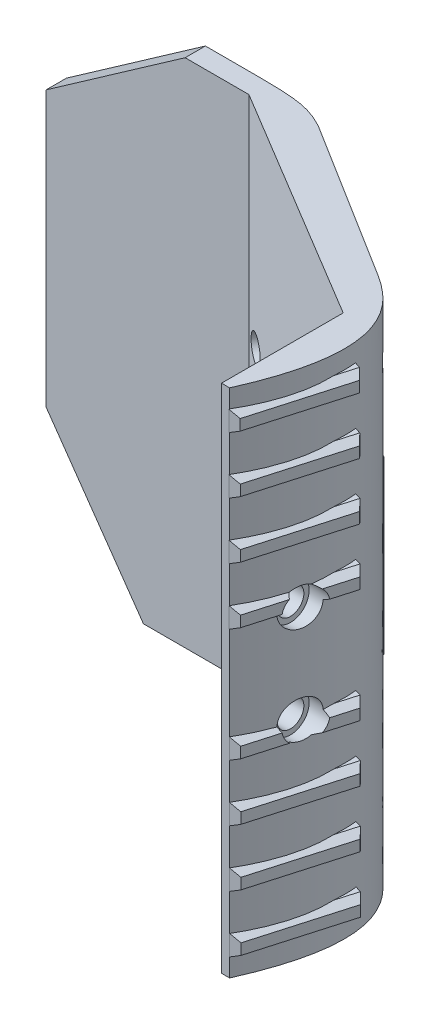
from build123d import *
from OCP.BRepFilletAPI import BRepFilletAPI_MakeChamfer

# Parameters (mm, degrees)
EXTRUDE_1_DEPTH           = 63
SKETCH_2_W                = 15
SKETCH_2_H                = 22
EXTRUDE_2_DEPTH           = 1
EXTRUDE_2_TAPER           = 25
CUT_EXTRUDE_1_DEPTH       = 0.6
SKETCH_7_W                = 9
SKETCH_7_H                = 26
EXTRUDE_4_DEPTH           = 2
EXTRUDE_4_TAPER           = 35
EXTRUDE_4_OTHER_WAY_DEPTH = 2
SKETCH_4_R                = 1.65
CUT_EXTRUDE_2_DEPTH       = 83.575294142
SKETCH_5_R                = 2.3
CUT_EXTRUDE_3_DEPTH       = 83.861648478
SKETCH_10_W               = 13.042406147
SKETCH_10_H               = 2.5
EXTRUDE_6_DEPTH           = 1
EXTRUDE_6_DRAFT           = -30
SKETCH_10_W_2             = 13.042406148
EXTRUDE_6_PROFILE_2_DEPTH = 1
EXTRUDE_6_PROFILE_2_DRAFT = -30
EXTRUDE_6_PROFILE_3_DEPTH = 1
EXTRUDE_6_PROFILE_3_DRAFT = -30
EXTRUDE_6_PROFILE_4_DEPTH = 1
EXTRUDE_6_PROFILE_4_DRAFT = -30
EXTRUDE_6_PROFILE_5_DEPTH = 1
EXTRUDE_6_PROFILE_5_DRAFT = -30
EXTRUDE_6_PROFILE_6_DEPTH = 1
EXTRUDE_6_PROFILE_6_DRAFT = -30
EXTRUDE_6_PROFILE_7_DEPTH = 1
EXTRUDE_6_PROFILE_7_DRAFT = -30
EXTRUDE_6_PROFILE_8_DEPTH = 1
EXTRUDE_6_PROFILE_8_DRAFT = -30
EXTRUDE_7_REACH           = 91.907
SKETCH_11_W               = 2.664181327
SKETCH_11_H               = 2.5
SKETCH_11_W_2             = 2.653969198
SKETCH_11_W_3             = 2.643757069
SKETCH_11_W_4             = 2.633544939
SKETCH_11_W_5             = 2.613120681
SKETCH_11_W_6             = 2.602908552
SKETCH_11_W_7             = 2.582484293
SKETCH_11_W_8             = 2.592696422
SKETCH_12_R               = 1.65
CUT_EXTRUDE_4_DEPTH       = 2
SKETCH_13_R               = 2.3
CUT_EXTRUDE_5_DEPTH       = 87.97206171
CHAMFER_1_SIZE            = 12
CHAMFER_1_SIZE2           = 17.137776081


with BuildPart() as part:
    # 草图1 → 凸台-拉伸1 (new body)
    with BuildSketch(Plane(origin=(0, 0, 0), x_dir=(1, 0, 0), z_dir=(0, 1, 0))):
        with BuildLine():
            Line((44.43880649, -6.019716675), (44.43880649, -21.019716675))
            Line((44.43880649, -21.019716675), (45.43880649, -21.019716675))
            add(Edge.make_bspline(
                [(41.651819028, 0.714585318), (45.340469838, -1.589284913), (52.31055273, -5.585521918), (45.43880649, -21.019716675)],
                knots=[0.746299074, 0.746299074, 0.746299074, 0.746299074, 1, 1, 1, 1], degree=3))
            Line((41.651819028, 0.714585318), (22.849473052, 12.458219345))
            add(Edge.make_bspline(
                [(12.078403115, 13.980283325), (18.082153885, 13.980283325), (20.026953764, 13.972630056), (22.849473052, 12.458219345)],
                knots=[0, 0, 0, 0, 0.428174205, 0.428174205, 0.428174205, 0.428174205], degree=3))
            Line((12.078403115, 13.980283325), (10.078403115, 13.980283325))
            Line((10.078403115, 13.980283325), (-9.686084451, 13.980283325))
            Line((-9.686084451, 13.980283325), (-9.686084451, 11.480283325))
            Line((-9.686084451, 11.480283325), (15.313915549, 11.480283325))
            Line((15.313915549, 11.480283325), (44.43880649, -6.019716675))
        make_face()
    extrude(amount=EXTRUDE_1_DEPTH)

    # 草图2 → 凸台-拉伸2 (add)
    with BuildSketch(Plane(origin=(12.009801855, 0, -19.228498526), x_dir=(-0.848157054218371, 0, -0.5297448549817312), z_dir=(0.5297448549817312, 0, -0.848157054218371))):
        with Locations((-26.948736234, 31.5)):
            Rectangle(SKETCH_2_W, SKETCH_2_H)
    extrude(amount=EXTRUDE_2_DEPTH, taper=EXTRUDE_2_TAPER)

    # 草图3 → 切除-拉伸1 (cut)
    with BuildSketch(Plane(origin=(12.53954671, 0, -20.07665558), x_dir=(-0.848157054218371, 0, -0.5297448549817311), z_dir=(0.5297448549817312, 0, -0.8481570542183711))):
        with BuildLine():
            Line((-24.827415891, 31.5), (-21.645435375, 34.681980515))
            ThreePointArc((-21.645435375, 34.681980515), (-21.645435375, 36.803300859), (-23.766755719, 36.803300859))
            Line((-23.766755719, 36.803300859), (-26.948736234, 33.621320344))
            Line((-26.948736234, 33.621320344), (-24.827415891, 31.5))
        make_face()
        Polygon((-26.948736234, 29.378679656), (-24.827415891, 31.5), (-26.948736234, 33.621320344), (-29.070056578, 31.5), align=None)
        with BuildLine():
            Line((-21.645435375, 28.318019485), (-24.827415891, 31.5))
            Line((-24.827415891, 31.5), (-26.948736234, 29.378679656))
            Line((-26.948736234, 29.378679656), (-23.766755719, 26.196699141))
            ThreePointArc((-23.766755719, 26.196699141), (-21.645435375, 26.196699141), (-21.645435375, 28.318019485))
        make_face()
        with BuildLine():
            Line((-30.13071675, 26.196699141), (-26.948736234, 29.378679656))
            Line((-26.948736234, 29.378679656), (-29.070056578, 31.5))
            Line((-29.070056578, 31.5), (-32.252037093, 28.318019485))
            ThreePointArc((-32.252037093, 28.318019485), (-32.252037093, 26.196699141), (-30.13071675, 26.196699141))
        make_face()
        with BuildLine():
            Line((-29.070056578, 31.5), (-26.948736234, 33.621320344))
            Line((-26.948736234, 33.621320344), (-30.13071675, 36.803300859))
            ThreePointArc((-30.13071675, 36.803300859), (-32.252037093, 36.803300859), (-32.252037093, 34.681980515))
            Line((-32.252037093, 34.681980515), (-29.070056578, 31.5))
        make_face()
    extrude(amount=-CUT_EXTRUDE_1_DEPTH, mode=Mode.SUBTRACT)

    # 草图7 → 凸台-拉伸4 (add)
    with BuildSketch(Plane(origin=(2.78506898, 0, -15.794911074), x_dir=(0.9848077530122076, 0, 0.1736481776669333), z_dir=(0.1736481776669333, 0, -0.9848077530122076))):
        with Locations((17.267254309, -31.5)):
            Rectangle(SKETCH_7_W, SKETCH_7_H)
    extrude(amount=EXTRUDE_4_DEPTH, taper=EXTRUDE_4_TAPER)

    # 草图7 → 凸台-拉伸4 other way (add)
    with BuildSketch(Plane(origin=(2.78506898, 0, -15.794911074), x_dir=(0.9848077530122076, 0, 0.1736481776669333), z_dir=(0.1736481776669333, 0, -0.9848077530122076))):
        with Locations((17.267254309, -31.5)):
            Rectangle(SKETCH_7_W, SKETCH_7_H)
    extrude(amount=-EXTRUDE_4_OTHER_WAY_DEPTH)

    # 草图4 → 切除-拉伸2 (cut, through all)
    with BuildSketch(Plane(origin=(9.130478106, 0, -15.195667375), x_dir=(0.8571673007021101, 0, 0.5150380749100577), z_dir=(-0.5150380749100577, 0, 0.8571673007021101))):
        with Locations((9.652833984, 25.5)):
            Circle(SKETCH_4_R)
        with Locations(Location((9.652833984, 37.5, 0), (0, 0, 180))):
            Circle(SKETCH_4_R)
    extrude(amount=-CUT_EXTRUDE_2_DEPTH, mode=Mode.SUBTRACT)

    # 草图5 → 切除-拉伸3 (cut, through all)
    with BuildSketch(Plane(origin=(10.160554255, 0, -16.910001977), x_dir=(0.8571673007021101, 0, 0.5150380749100577), z_dir=(-0.5150380749100577, 0, 0.8571673007021101))):
        with Locations((9.652833984, 25.5)):
            Circle(SKETCH_5_R)
        with Locations((9.652833984, 37.5)):
            Circle(SKETCH_5_R)
    extrude(amount=-CUT_EXTRUDE_3_DEPTH, mode=Mode.SUBTRACT)


with BuildPart() as extrude_6_tool:
    # 草图10 → 凸台-拉伸6 (with draft: the straight prism first)
    with BuildSketch(Plane(origin=(47.55592631, 0, 13.636442435), x_dir=(-0.2756373558169962, 0, 0.9612616959383197), z_dir=(-0.9612616959383197, 0, -0.2756373558169962))):
        with Locations((1.159612952, 3.500029796)):
            Rectangle(SKETCH_10_W, SKETCH_10_H)
    extrude(amount=-EXTRUDE_6_DEPTH)
    # 凸台-拉伸6: the draft: its side faces are tilted about the plane it starts from
    extrude_6_sides = [extrude_6_tool.faces().sort_by_distance(p)[0] for p in [
        (47.71692451, 4.750029796, 14.888952626),
        (49.514411682, 3.500029796, 8.6203699),
        (47.71692451, 2.250029796, 14.888952626),
        (45.919437338, 3.500029796, 21.157535352),
    ]]
    draft(extrude_6_sides, Plane(origin=(47.55592631, 0, 13.636442435), x_dir=(-0.2756373558169962, 0, 0.9612616959383197), z_dir=(-0.9612616959383197, 0, -0.2756373558169962)), EXTRUDE_6_DRAFT)


with BuildPart() as part_1:
    add(part.part)

    # 凸台-拉伸6: add extrude_6_tool
    add(extrude_6_tool.part)


with BuildPart() as extrude_6_profile_2_tool:
    # 草图10 → 凸台-拉伸6 profile 2 (with draft: the straight prism first)
    with BuildSketch(Plane(origin=(47.55592631, 0, 13.636442435), x_dir=(-0.2756373558169962, 0, 0.9612616959383197), z_dir=(-0.9612616959383197, 0, -0.2756373558169962))):
        with Locations((1.169825082, 10.500022347)):
            Rectangle(SKETCH_10_W_2, SKETCH_10_H)
    extrude(amount=-EXTRUDE_6_PROFILE_2_DEPTH)
    # 凸台-拉伸6 profile 2: the draft: its side faces are tilted about the plane it starts from
    extrude_6_profile_2_sides = [extrude_6_profile_2_tool.faces().sort_by_distance(p)[0] for p in [
        (47.714109666, 11.750022347, 14.898769155),
        (49.511596838, 10.500022347, 8.630186429),
        (47.714109666, 9.250022347, 14.898769155),
        (45.916622494, 10.500022347, 21.167351881),
    ]]
    draft(extrude_6_profile_2_sides, Plane(origin=(47.55592631, 0, 13.636442435), x_dir=(-0.2756373558169962, 0, 0.9612616959383197), z_dir=(-0.9612616959383197, 0, -0.2756373558169962)), EXTRUDE_6_PROFILE_2_DRAFT)


with BuildPart() as part_2:
    add(part_1.part)

    # 凸台-拉伸6 profile 2: add extrude_6_profile_2_tool
    add(extrude_6_profile_2_tool.part)


with BuildPart() as extrude_6_profile_3_tool:
    # 草图10 → 凸台-拉伸6 profile 3 (with draft: the straight prism first)
    with BuildSketch(Plane(origin=(47.55592631, 0, 13.636442435), x_dir=(-0.2756373558169962, 0, 0.9612616959383197), z_dir=(-0.9612616959383197, 0, -0.2756373558169962))):
        with Locations((1.190249341, 24.500007449)):
            Rectangle(SKETCH_10_W, SKETCH_10_H)
    extrude(amount=-EXTRUDE_6_PROFILE_3_DEPTH)
    # 凸台-拉伸6 profile 3: the draft: its side faces are tilted about the plane it starts from
    extrude_6_profile_3_sides = [extrude_6_profile_3_tool.faces().sort_by_distance(p)[0] for p in [
        (47.708479977, 25.750007449, 14.918402212),
        (49.505967149, 24.500007449, 8.649819486),
        (47.708479977, 23.250007449, 14.918402212),
        (45.910992805, 24.500007449, 21.186984939),
    ]]
    draft(extrude_6_profile_3_sides, Plane(origin=(47.55592631, 0, 13.636442435), x_dir=(-0.2756373558169962, 0, 0.9612616959383197), z_dir=(-0.9612616959383197, 0, -0.2756373558169962)), EXTRUDE_6_PROFILE_3_DRAFT)


with BuildPart() as part_3:
    add(part_2.part)

    # 凸台-拉伸6 profile 3: add extrude_6_profile_3_tool
    add(extrude_6_profile_3_tool.part)


with BuildPart() as extrude_6_profile_4_tool:
    # 草图10 → 凸台-拉伸6 profile 4 (with draft: the straight prism first)
    with BuildSketch(Plane(origin=(47.55592631, 0, 13.636442435), x_dir=(-0.2756373558169962, 0, 0.9612616959383197), z_dir=(-0.9612616959383197, 0, -0.2756373558169962))):
        with Locations((1.220885728, 45.499985102)):
            Rectangle(SKETCH_10_W_2, SKETCH_10_H)
    extrude(amount=-EXTRUDE_6_PROFILE_4_DEPTH)
    # 凸台-拉伸6 profile 4: the draft: its side faces are tilted about the plane it starts from
    extrude_6_profile_4_sides = [extrude_6_profile_4_tool.faces().sort_by_distance(p)[0] for p in [
        (47.700035444, 46.749985102, 14.947851798),
        (49.497522616, 45.499985102, 8.679269072),
        (47.700035444, 44.249985102, 14.947851798),
        (45.902548272, 45.499985102, 21.216434525),
    ]]
    draft(extrude_6_profile_4_sides, Plane(origin=(47.55592631, 0, 13.636442435), x_dir=(-0.2756373558169962, 0, 0.9612616959383197), z_dir=(-0.9612616959383197, 0, -0.2756373558169962)), EXTRUDE_6_PROFILE_4_DRAFT)


with BuildPart() as part_4:
    add(part_3.part)

    # 凸台-拉伸6 profile 4: add extrude_6_profile_4_tool
    add(extrude_6_profile_4_tool.part)


with BuildPart() as extrude_6_profile_5_tool:
    # 草图10 → 凸台-拉伸6 profile 5 (with draft: the straight prism first)
    with BuildSketch(Plane(origin=(47.55592631, 0, 13.636442435), x_dir=(-0.2756373558169962, 0, 0.9612616959383197), z_dir=(-0.9612616959383197, 0, -0.2756373558169962))):
        with Locations((1.231097858, 52.499977653)):
            Rectangle(SKETCH_10_W, SKETCH_10_H)
    extrude(amount=-EXTRUDE_6_PROFILE_5_DEPTH)
    # 凸台-拉伸6 profile 5: the draft: its side faces are tilted about the plane it starts from
    extrude_6_profile_5_sides = [extrude_6_profile_5_tool.faces().sort_by_distance(p)[0] for p in [
        (47.6972206, 53.749977653, 14.957668327),
        (49.494707772, 52.499977653, 8.689085601),
        (47.6972206, 51.249977653, 14.957668327),
        (45.899733428, 52.499977653, 21.226251053),
    ]]
    draft(extrude_6_profile_5_sides, Plane(origin=(47.55592631, 0, 13.636442435), x_dir=(-0.2756373558169962, 0, 0.9612616959383197), z_dir=(-0.9612616959383197, 0, -0.2756373558169962)), EXTRUDE_6_PROFILE_5_DRAFT)


with BuildPart() as part_5:
    add(part_4.part)

    # 凸台-拉伸6 profile 5: add extrude_6_profile_5_tool
    add(extrude_6_profile_5_tool.part)


with BuildPart() as extrude_6_profile_6_tool:
    # 草图10 → 凸台-拉伸6 profile 6 (with draft: the straight prism first)
    with BuildSketch(Plane(origin=(47.55592631, 0, 13.636442435), x_dir=(-0.2756373558169962, 0, 0.9612616959383197), z_dir=(-0.9612616959383197, 0, -0.2756373558169962))):
        with Locations((1.241309987, 59.499970204)):
            Rectangle(SKETCH_10_W, SKETCH_10_H)
    extrude(amount=-EXTRUDE_6_PROFILE_6_DEPTH)
    # 凸台-拉伸6 profile 6: the draft: its side faces are tilted about the plane it starts from
    extrude_6_profile_6_sides = [extrude_6_profile_6_tool.faces().sort_by_distance(p)[0] for p in [
        (47.694405756, 60.749970204, 14.967484856),
        (49.491892928, 59.499970204, 8.698902129),
        (47.694405756, 58.249970204, 14.967484856),
        (45.896918584, 59.499970204, 21.236067582),
    ]]
    draft(extrude_6_profile_6_sides, Plane(origin=(47.55592631, 0, 13.636442435), x_dir=(-0.2756373558169962, 0, 0.9612616959383197), z_dir=(-0.9612616959383197, 0, -0.2756373558169962)), EXTRUDE_6_PROFILE_6_DRAFT)


with BuildPart() as part_6:
    add(part_5.part)

    # 凸台-拉伸6 profile 6: add extrude_6_profile_6_tool
    add(extrude_6_profile_6_tool.part)


with BuildPart() as extrude_6_profile_7_tool:
    # 草图10 → 凸台-拉伸6 profile 7 (with draft: the straight prism first)
    with BuildSketch(Plane(origin=(47.55592631, 0, 13.636442435), x_dir=(-0.2756373558169962, 0, 0.9612616959383197), z_dir=(-0.9612616959383197, 0, -0.2756373558169962))):
        with Locations((1.180037211, 17.500014898)):
            Rectangle(SKETCH_10_W_2, SKETCH_10_H)
    extrude(amount=-EXTRUDE_6_PROFILE_7_DEPTH)
    # 凸台-拉伸6 profile 7: the draft: its side faces are tilted about the plane it starts from
    extrude_6_profile_7_sides = [extrude_6_profile_7_tool.faces().sort_by_distance(p)[0] for p in [
        (49.508781993, 17.500014898, 8.640002957),
        (47.711294821, 16.250014898, 14.908585684),
        (45.913807649, 17.500014898, 21.17716841),
        (47.711294821, 18.750014898, 14.908585684),
    ]]
    draft(extrude_6_profile_7_sides, Plane(origin=(47.55592631, 0, 13.636442435), x_dir=(-0.2756373558169962, 0, 0.9612616959383197), z_dir=(-0.9612616959383197, 0, -0.2756373558169962)), EXTRUDE_6_PROFILE_7_DRAFT)


with BuildPart() as part_7:
    add(part_6.part)

    # 凸台-拉伸6 profile 7: add extrude_6_profile_7_tool
    add(extrude_6_profile_7_tool.part)


with BuildPart() as extrude_6_profile_8_tool:
    # 草图10 → 凸台-拉伸6 profile 8 (with draft: the straight prism first)
    with BuildSketch(Plane(origin=(47.55592631, 0, 13.636442435), x_dir=(-0.2756373558169962, 0, 0.9612616959383197), z_dir=(-0.9612616959383197, 0, -0.2756373558169962))):
        with Locations((1.210673599, 38.499992551)):
            Rectangle(SKETCH_10_W_2, SKETCH_10_H)
    extrude(amount=-EXTRUDE_6_PROFILE_8_DEPTH)
    # 凸台-拉伸6 profile 8: the draft: its side faces are tilted about the plane it starts from
    extrude_6_profile_8_sides = [extrude_6_profile_8_tool.faces().sort_by_distance(p)[0] for p in [
        (49.50033746, 38.499992551, 8.669452543),
        (47.702850288, 37.249992551, 14.93803527),
        (45.905363116, 38.499992551, 21.206617996),
        (47.702850288, 39.749992551, 14.93803527),
    ]]
    draft(extrude_6_profile_8_sides, Plane(origin=(47.55592631, 0, 13.636442435), x_dir=(-0.2756373558169962, 0, 0.9612616959383197), z_dir=(-0.9612616959383197, 0, -0.2756373558169962)), EXTRUDE_6_PROFILE_8_DRAFT)


with BuildPart() as part_8:
    add(part_7.part)

    # 凸台-拉伸6 profile 8: add extrude_6_profile_8_tool
    add(extrude_6_profile_8_tool.part)

    # 草图11 → 凸台-拉伸7 (add, up to next)
    with BuildSketch(Plane(origin=(47.55592631, 0, 13.636442435), x_dir=(-0.2756373558169962, 0, 0.9612616959383197), z_dir=(-0.9612616959383197, 0, -0.2756373558169962)), mode=Mode.PRIVATE) as extrude_7_sk1:
        with Locations((-4.029499458, 3.500029796)):
            Rectangle(SKETCH_11_W, SKETCH_11_H)
    extrude_7_tool1 = extrude(extrude_7_sk1.sketch, amount=EXTRUDE_7_REACH, mode=Mode.PRIVATE) - part_8.part
    # 草图11 → 凸台-拉伸7 (add, up to next)
    with BuildSketch(Plane(origin=(47.55592631, 0, 13.636442435), x_dir=(-0.2756373558169962, 0, 0.9612616959383197), z_dir=(-0.9612616959383197, 0, -0.2756373558169962)), mode=Mode.PRIVATE) as extrude_7_sk2:
        with Locations((-4.024393393, 10.500022347)):
            Rectangle(SKETCH_11_W_2, SKETCH_11_H)
    extrude_7_tool2 = extrude(extrude_7_sk2.sketch, amount=EXTRUDE_7_REACH, mode=Mode.PRIVATE) - part_8.part
    # 草图11 → 凸台-拉伸7 (add, up to next)
    with BuildSketch(Plane(origin=(47.55592631, 0, 13.636442435), x_dir=(-0.2756373558169962, 0, 0.9612616959383197), z_dir=(-0.9612616959383197, 0, -0.2756373558169962)), mode=Mode.PRIVATE) as extrude_7_sk3:
        with Locations((-4.019287329, 17.500014898)):
            Rectangle(SKETCH_11_W_3, SKETCH_11_H)
    extrude_7_tool3 = extrude(extrude_7_sk3.sketch, amount=EXTRUDE_7_REACH, mode=Mode.PRIVATE) - part_8.part
    # 草图11 → 凸台-拉伸7 (add, up to next)
    with BuildSketch(Plane(origin=(47.55592631, 0, 13.636442435), x_dir=(-0.2756373558169962, 0, 0.9612616959383197), z_dir=(-0.9612616959383197, 0, -0.2756373558169962)), mode=Mode.PRIVATE) as extrude_7_sk4:
        with Locations((-4.014181264, 24.500007449)):
            Rectangle(SKETCH_11_W_4, SKETCH_11_H)
    extrude_7_tool4 = extrude(extrude_7_sk4.sketch, amount=EXTRUDE_7_REACH, mode=Mode.PRIVATE) - part_8.part
    # 草图11 → 凸台-拉伸7 (add, up to next)
    with BuildSketch(Plane(origin=(47.55592631, 0, 13.636442435), x_dir=(-0.2756373558169962, 0, 0.9612616959383197), z_dir=(-0.9612616959383197, 0, -0.2756373558169962)), mode=Mode.PRIVATE) as extrude_7_sk5:
        with Locations((-4.003969135, 38.499992551)):
            Rectangle(SKETCH_11_W_5, SKETCH_11_H)
    extrude_7_tool5 = extrude(extrude_7_sk5.sketch, amount=EXTRUDE_7_REACH, mode=Mode.PRIVATE) - part_8.part
    # 草图11 → 凸台-拉伸7 (add, up to next)
    with BuildSketch(Plane(origin=(47.55592631, 0, 13.636442435), x_dir=(-0.2756373558169962, 0, 0.9612616959383197), z_dir=(-0.9612616959383197, 0, -0.2756373558169962)), mode=Mode.PRIVATE) as extrude_7_sk6:
        with Locations((-3.99886307, 45.499985102)):
            Rectangle(SKETCH_11_W_6, SKETCH_11_H)
    extrude_7_tool6 = extrude(extrude_7_sk6.sketch, amount=EXTRUDE_7_REACH, mode=Mode.PRIVATE) - part_8.part
    # 草图11 → 凸台-拉伸7 (add, up to next)
    with BuildSketch(Plane(origin=(47.55592631, 0, 13.636442435), x_dir=(-0.2756373558169962, 0, 0.9612616959383197), z_dir=(-0.9612616959383197, 0, -0.2756373558169962)), mode=Mode.PRIVATE) as extrude_7_sk7:
        with Locations((-3.988650941, 59.499970204)):
            Rectangle(SKETCH_11_W_7, SKETCH_11_H)
    extrude_7_tool7 = extrude(extrude_7_sk7.sketch, amount=EXTRUDE_7_REACH, mode=Mode.PRIVATE) - part_8.part
    # 草图11 → 凸台-拉伸7 (add, up to next)
    with BuildSketch(Plane(origin=(47.55592631, 0, 13.636442435), x_dir=(-0.2756373558169962, 0, 0.9612616959383197), z_dir=(-0.9612616959383197, 0, -0.2756373558169962)), mode=Mode.PRIVATE) as extrude_7_sk8:
        with Locations((-3.993757005, 52.499977653)):
            Rectangle(SKETCH_11_W_8, SKETCH_11_H)
    extrude_7_tool8 = extrude(extrude_7_sk8.sketch, amount=EXTRUDE_7_REACH, mode=Mode.PRIVATE) - part_8.part
    add(extrude_7_tool1.solids().sort_by_distance((48.666607, 3.50003, 9.763039))[0])
    add(extrude_7_tool2.solids().sort_by_distance((48.665199, 10.500022, 9.767947))[0])
    add(extrude_7_tool3.solids().sort_by_distance((48.663792, 17.500015, 9.772855))[0])
    add(extrude_7_tool4.solids().sort_by_distance((48.662385, 24.500007, 9.777764))[0])
    add(extrude_7_tool5.solids().sort_by_distance((48.65957, 38.499993, 9.78758))[0])
    add(extrude_7_tool6.solids().sort_by_distance((48.658162, 45.499985, 9.792489))[0])
    add(extrude_7_tool7.solids().sort_by_distance((48.655348, 59.49997, 9.802305))[0])
    add(extrude_7_tool8.solids().sort_by_distance((48.656755, 52.499978, 9.797397))[0])

    # 草图12 → 切除-拉伸4 (cut)
    with BuildSketch(Plane.ZY.offset(-44.43880649)):
        with Locations((14.519716675, 25.5)):
            Circle(SKETCH_12_R)
        with Locations(Location((14.519716675, 37.5, 0), (0, 0, 180))):
            Circle(SKETCH_12_R)
    extrude(amount=-CUT_EXTRUDE_4_DEPTH, mode=Mode.SUBTRACT)

    # 草图13 → 切除-拉伸5 (cut, through all)
    with BuildSketch(Plane.ZY.offset(-46.43880649)):
        with Locations((14.519716675, 25.5)):
            Circle(SKETCH_13_R)
        with Locations((14.519716675, 37.5)):
            Circle(SKETCH_13_R)
    extrude(amount=-CUT_EXTRUDE_5_DEPTH, mode=Mode.SUBTRACT)

    # 倒角1: one chamfer whose edges measure the first distance from different faces: ONE call of the kernel's chamfer builder (chamfer() names one face for all edges)
    chamfer_1_edges_1 = [part_8.edges().sort_by_distance(p)[0] for p in [
        (-9.686084451, 0, -12.730283325),
    ]]
    chamfer_1_side_1 = [part_8.faces().sort_by_distance(p)[0] for p in [
        (45.116532055, 0, 13.519716675),
    ]]
    chamfer_1_edges_2 = [part_8.edges().sort_by_distance(p)[0] for p in [
        (-9.686084451, 63, -12.730283325),
    ]]
    chamfer_1_side_2 = [part_8.faces().sort_by_distance(p)[0] for p in [
        (-9.686084451, 31.5, -12.730283325),
    ]]
    chamfer_1 = BRepFilletAPI_MakeChamfer(part_8.part.solid().wrapped)
    for e in chamfer_1_edges_1:
        chamfer_1.Add(CHAMFER_1_SIZE, CHAMFER_1_SIZE2, e.wrapped, chamfer_1_side_1[0].wrapped)  # the first distance lies on this face
    for e in chamfer_1_edges_2:
        chamfer_1.Add(CHAMFER_1_SIZE, CHAMFER_1_SIZE2, e.wrapped, chamfer_1_side_2[0].wrapped)  # the first distance lies on this face
    add(Compound.cast(chamfer_1.Shape()), mode=Mode.REPLACE)


solid = part_8.part
